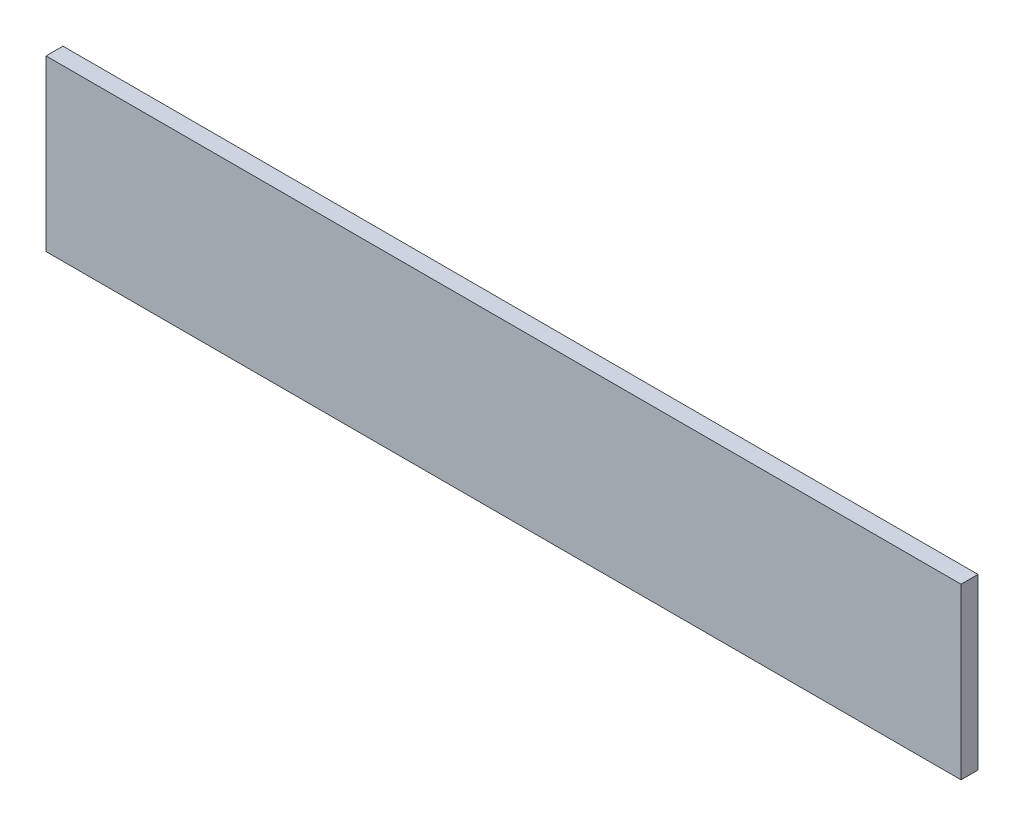
from build123d import *

# Parameters (mm, degrees)
ESQUISSE1_W        = 270
ESQUISSE1_H        = 50
BOSS_EXTRU_1_DEPTH = 5


with BuildPart() as part:
    # Esquisse1 → Boss.-Extru.1 (new body)
    with BuildSketch(Plane.XY):
        Rectangle(ESQUISSE1_W, ESQUISSE1_H)
    extrude(amount=BOSS_EXTRU_1_DEPTH)


solid = part.part
